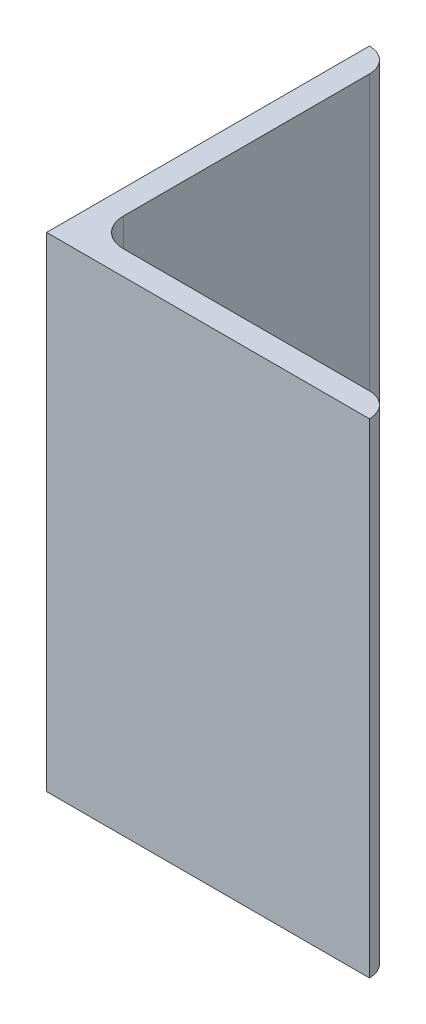
from build123d import *

# Parameters (mm, degrees)
IRON_V40X40X3_1_DEPTH = 60


with BuildPart() as part:
    # Sketch11 → Iron V40X40X3(1) (new body)
    with BuildSketch(Plane(origin=(0, 0, 0), x_dir=(1, 0, 0), z_dir=(0, 1, 0))):
        with BuildLine():
            Line((0, 0), (0, 40))
            ThreePointArc((0, 40), (2.121320344, 39.121320344), (3, 37))
            Line((3, 37), (3, 6.5))
            ThreePointArc((3, 6.5), (4.025126266, 4.025126266), (6.5, 3))
            Line((6.5, 3), (37, 3))
            ThreePointArc((37, 3), (39.121320344, 2.121320344), (40, 0))
            Line((40, 0), (0, 0))
        make_face()
    extrude(amount=IRON_V40X40X3_1_DEPTH)


solid = part.part
